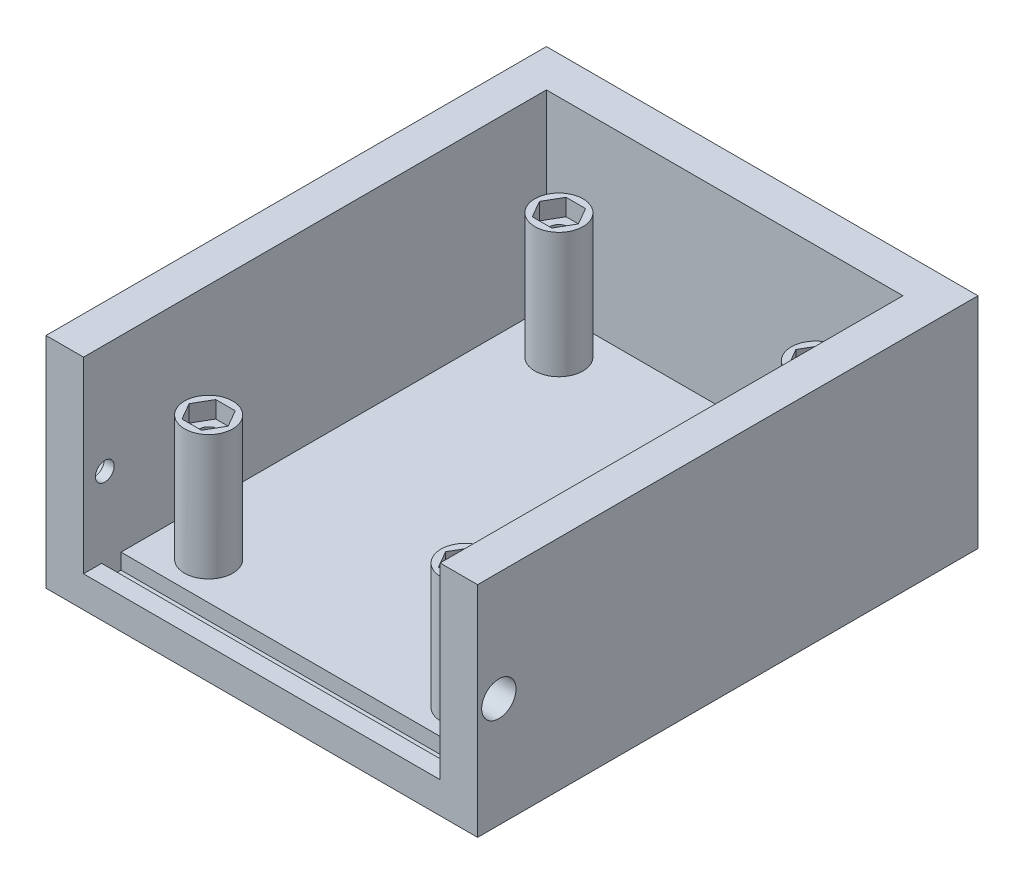
from build123d import *

# Parameters (mm, degrees)
SKETCH1_W                                = 65
SKETCH1_H                                = 80
BOSS_EXTRUDE1_DEPTH                      = 5
SKETCH2_W                                = 65
SKETCH2_H                                = 80
SKETCH2_W_2                              = 57
SKETCH2_H_2                              = 68
BOSS_EXTRUDE2_DEPTH                      = 30
SKETCH3_R                                = 3.85
BOSS_EXTRUDE3_DEPTH                      = 20
F_3_0MM_DOWEL_HOLE1_D                    = 3
F_3_0MM_DOWEL_HOLE1_DEPTH                = 8.5
F_3_0MM_DOWEL_HOLE1_CSINK_D              = 3.05
F_3_0MM_DOWEL_HOLE1_CSINK_ANGLE          = 90
F_3_0MM_DOWEL_HOLE1_TIP                  = 0.901290929
CUT_EXTRUDE1_DEPTH                       = 2.7
MIRROR1_AT_THE_SECOND_PLANE_COPY_1_DEPTH = 2.7
SKETCH13_R                               = 2.75
CUT_EXTRUDE4_DEPTH                       = 2.4
SKETCH14_R                               = 1.5
CUT_EXTRUDE5_DEPTH                       = 4
SKETCH11_W                               = 57
SKETCH11_H                               = 6
CUT_EXTRUDE2_DEPTH                       = 30
SKETCH15_W                               = 57
SKETCH15_H                               = 3.1
CUT_EXTRUDE6_DEPTH                       = 2.5
SKETCH16_W                               = 80
SKETCH16_H                               = 35
SKETCH16_R                               = 2.75
BOSS_EXTRUDE4_DEPTH                      = 2


with BuildPart() as part:
    # Sketch1 → Boss-Extrude1 (new body)
    with BuildSketch(Plane(origin=(0, 0, 0), x_dir=(1, 0, 0), z_dir=(0, 1, 0))):
        Rectangle(SKETCH1_W, SKETCH1_H)
    extrude(amount=BOSS_EXTRUDE1_DEPTH)

    # Sketch2 → Boss-Extrude2 (add)
    with BuildSketch(Plane(origin=(0, 5, 0), x_dir=(1, 0, 0), z_dir=(0, 1, 0))):
        Rectangle(SKETCH2_W, SKETCH2_H)
        Rectangle(SKETCH2_W_2, SKETCH2_H_2, mode=Mode.SUBTRACT)
    extrude(amount=BOSS_EXTRUDE2_DEPTH)

    # Sketch3 → Boss-Extrude3 (add)
    with BuildSketch(Plane(origin=(0, 5, 0), x_dir=(1, 0, 0), z_dir=(0, 1, 0))):
        with Locations(Location((-20.5, -28, 0), (0, 0, 90))):
            Circle(SKETCH3_R)
        with Locations(Location((20.5, -28, 0), (0, 0, 90))):
            Circle(SKETCH3_R)
        with Locations(Location((20.5, 28, 0), (0, 0, 90))):
            Circle(SKETCH3_R)
        with Locations(Location((-20.5, 28, 0), (0, 0, 90))):
            Circle(SKETCH3_R)
    extrude(amount=BOSS_EXTRUDE3_DEPTH)

    # Ø3.0mm Dowel Hole1
    with Locations(Plane(origin=(0, 25, 0), x_dir=(1, 0, 0), z_dir=(0, 1, 0))):
        with Locations((-20.5, 28), (20.5, 28), (20.5, -28), (-20.5, -28)):
            CounterSinkHole(F_3_0MM_DOWEL_HOLE1_D / 2, F_3_0MM_DOWEL_HOLE1_CSINK_D / 2, depth=F_3_0MM_DOWEL_HOLE1_DEPTH, counter_sink_angle=F_3_0MM_DOWEL_HOLE1_CSINK_ANGLE)
            with Locations((0, 0, -(F_3_0MM_DOWEL_HOLE1_DEPTH + F_3_0MM_DOWEL_HOLE1_TIP / 2))):  # 118° drill point
                Cone(0, F_3_0MM_DOWEL_HOLE1_D / 2, F_3_0MM_DOWEL_HOLE1_TIP, mode=Mode.SUBTRACT)

    # Sketch8 → Cut-Extrude1 (cut)
    with BuildSketch(Plane(origin=(0, 25, 0), x_dir=(1, 0, 0), z_dir=(0, 1, 0))):
        Polygon((-17.382308546, 28), (-18.941154273, 30.7), (-22.058845727, 30.7), (-23.617691454, 28), (-22.058845727, 25.3), (-18.941154273, 25.3), align=None)
    cut_extrude1 = extrude(amount=-CUT_EXTRUDE1_DEPTH, mode=Mode.SUBTRACT)

    # Mirror1: Cut-Extrude1 across plane
    add(cut_extrude1.mirror(Plane.XY), mode=Mode.SUBTRACT)

    # Mirror1 at the second plane: Cut-Extrude1 across plane
    add(cut_extrude1.mirror(Plane(origin=(0, 0, 0), x_dir=(0, 0, 1), z_dir=(1, 0, 0))), mode=Mode.SUBTRACT)

    # Mirror1 at the second plane copy 1 sketc → Mirror1 at the second plane copy 1 (cut)
    with BuildSketch(Plane(origin=(0, 25, 0), x_dir=(-1, 0, 0), z_dir=(0, 1, 0))):
        Polygon((-17.382308546, 28), (-18.941154273, 30.7), (-22.058845727, 30.7), (-23.617691454, 28), (-22.058845727, 25.3), (-18.941154273, 25.3), align=None)
    extrude(amount=-MIRROR1_AT_THE_SECOND_PLANE_COPY_1_DEPTH, mode=Mode.SUBTRACT)

    # Sketch13 → Cut-Extrude4 (cut)
    with BuildSketch(Plane(origin=(32.5, 0, 0), x_dir=(0, 0, -1), z_dir=(1, 0, 0))):
        with Locations((-36.6, 17.5)):
            Circle(SKETCH13_R)
    cut_extrude4 = extrude(amount=-CUT_EXTRUDE4_DEPTH, mode=Mode.SUBTRACT)

    # Sketch14 → Cut-Extrude5 (cut)
    with BuildSketch(Plane(origin=(32.5, 0, 0), x_dir=(0, 0, -1), z_dir=(1, 0, 0))):
        with Locations((-36.6, 17.5)):
            Circle(SKETCH14_R)
    cut_extrude5 = extrude(amount=-CUT_EXTRUDE5_DEPTH, mode=Mode.SUBTRACT)

    # Mirror2: Cut-Extrude4, Cut-Extrude5 across plane
    add(cut_extrude4.mirror(Plane(origin=(0, 0, 0), x_dir=(0, 0, 1), z_dir=(1, 0, 0))), mode=Mode.SUBTRACT)
    add(cut_extrude5.mirror(Plane(origin=(0, 0, 0), x_dir=(0, 0, 1), z_dir=(1, 0, 0))), mode=Mode.SUBTRACT)

    # Sketch11 → Cut-Extrude2 (cut)
    with BuildSketch(Plane(origin=(0, 35, 0), x_dir=(1, 0, 0), z_dir=(0, 1, 0))):
        with Locations((0, -37)):
            Rectangle(SKETCH11_W, SKETCH11_H)
    extrude(amount=-CUT_EXTRUDE2_DEPTH, mode=Mode.SUBTRACT)

    # Sketch15 → Cut-Extrude6 (cut)
    with BuildSketch(Plane(origin=(0, 5, 0), x_dir=(1, 0, 0), z_dir=(0, 1, 0))):
        with Locations((0, -35.55)):
            Rectangle(SKETCH15_W, SKETCH15_H)
    extrude(amount=-CUT_EXTRUDE6_DEPTH, mode=Mode.SUBTRACT)

    # Sketch16 → Boss-Extrude4 (add)
    with BuildSketch(Plane.ZY.offset(32.5)):
        with Locations((0, 17.5)):
            Rectangle(SKETCH16_W, SKETCH16_H)
        with Locations(Location((36.6, 17.5, 0), (0, 0, 180))):
            Circle(SKETCH16_R, mode=Mode.SUBTRACT)
    boss_extrude4 = extrude(amount=BOSS_EXTRUDE4_DEPTH)

    # Mirror3: Boss-Extrude4 across plane
    add(boss_extrude4.mirror(Plane(origin=(0, 0, 0), x_dir=(0, 0, 1), z_dir=(1, 0, 0))))


solid = part.part
